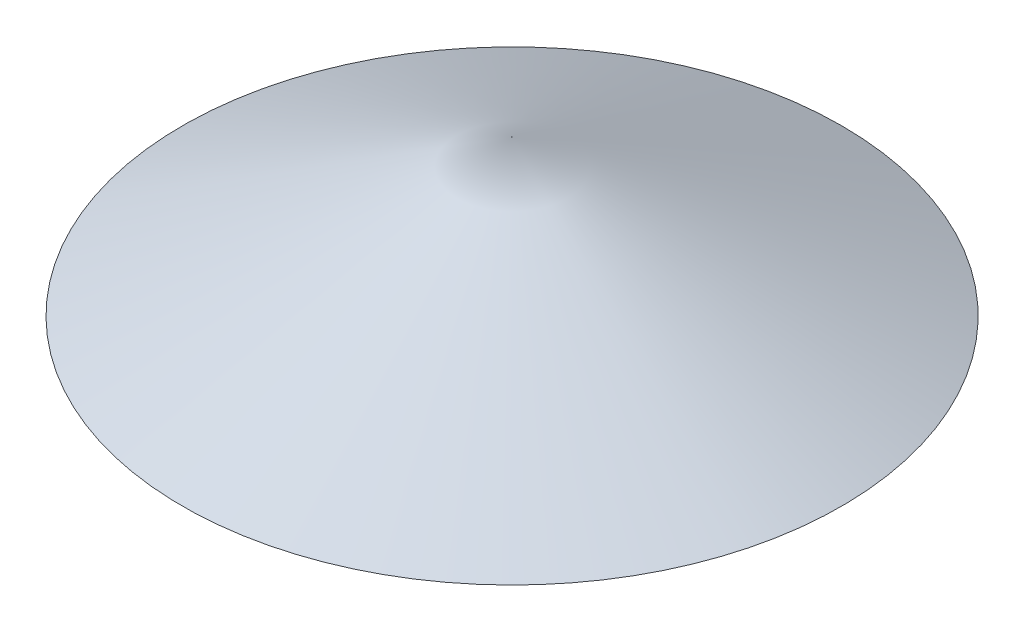
from build123d import *


with BuildPart() as part:
    # Esboço1 → Revolução1 (revolve)
    with BuildSketch(Plane.XY, mode=Mode.PRIVATE) as revolu_o1_sk:
        Polygon((0, 0), (0, 0.4), (-0.85, 0), align=None)
    revolve(revolu_o1_sk.sketch.rotate(Axis((0, 0, 0), (0, 1, 0)), 270), axis=Axis((0, 0, 0), (0, 1, 0)))


solid = part.part
